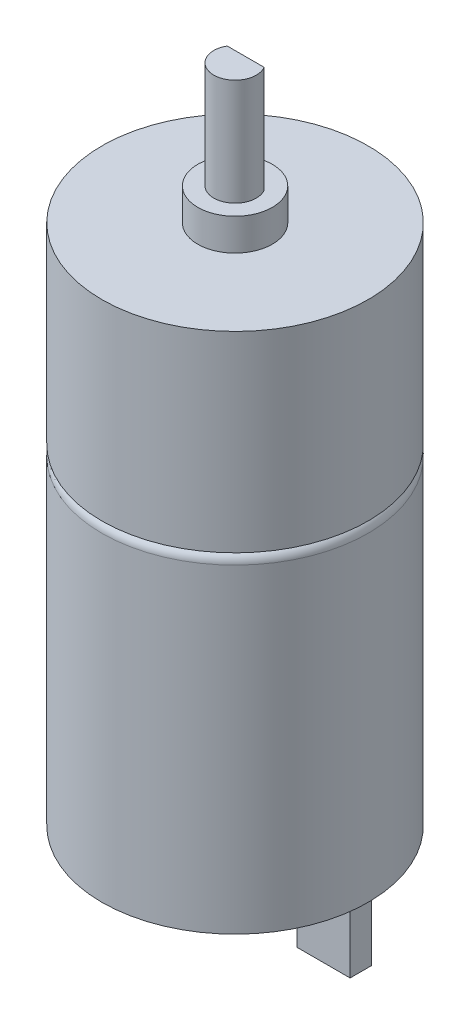
from build123d import *

# Parameters (mm, degrees)
ESBO_O1_R                = 12.5
RESSALTO_EXTRUS_O1_DEPTH = 31
FILETE1_R                = 1
ESBO_O2_R                = 12.5
RESSALTO_EXTRUS_O2_DEPTH = 18
ESBO_O3_W                = 5
ESBO_O3_H                = 2
RESSALTO_EXTRUS_O3_DEPTH = 6
ESBO_O5_R                = 3.5
RESSALTO_EXTRUS_O4_DEPTH = 3
RESSALTO_EXTRUS_O5_DEPTH = 10


with BuildPart() as part:
    # Esboço1 → Ressalto-extrusão1 (new body)
    with BuildSketch(Plane(origin=(0, 0, 0), x_dir=(1, 0, 0), z_dir=(0, 1, 0))):
        with Locations(Location((0, 0, 0), (0, 0, 270))):
            Circle(ESBO_O1_R)
    extrude(amount=RESSALTO_EXTRUS_O1_DEPTH)

    # Filete1
    filete1_edges = [part.edges().sort_by_distance(p)[0] for p in [
        (0, 31, -12.5),
    ]]
    fillet(filete1_edges, radius=FILETE1_R)

    # Esboço2 → Ressalto-extrusão2 (add)
    with BuildSketch(Plane(origin=(0, 31, 0), x_dir=(1, 0, 0), z_dir=(0, 1, 0))):
        with Locations(Location((0, 0, 0), (0, 0, 270))):
            Circle(ESBO_O2_R)
    extrude(amount=RESSALTO_EXTRUS_O2_DEPTH)

    # Esboço3 → Ressalto-extrusão3 (add)
    with BuildSketch(Plane.XZ):
        with Locations((9.3, 0)):
            Rectangle(ESBO_O3_W, ESBO_O3_H)
        with Locations((-9.3, 0)):
            Rectangle(ESBO_O3_W, ESBO_O3_H)
    extrude(amount=RESSALTO_EXTRUS_O3_DEPTH)

    # Esboço5 → Ressalto-extrusão4 (add)
    with BuildSketch(Plane(origin=(0, 49, 0), x_dir=(1, 0, 0), z_dir=(0, 1, 0))):
        with Locations(Location((0, 0, 0), (0, 0, 270))):
            Circle(ESBO_O5_R)
    extrude(amount=RESSALTO_EXTRUS_O4_DEPTH)

    # Esboço6 → Ressalto-extrusão5 (add)
    with BuildSketch(Plane(origin=(0, 52, 0), x_dir=(1, 0, 0), z_dir=(0, 1, 0))):
        with BuildLine():
            ThreePointArc((-1.732050808, 1), (0, -2), (1.732050808, 1))
            Line((1.732050808, 1), (-1.732050808, 1))
        make_face()
    extrude(amount=RESSALTO_EXTRUS_O5_DEPTH)


solid = part.part
